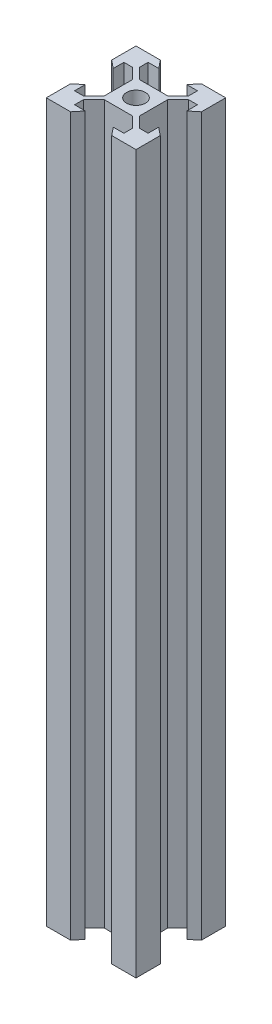
from build123d import *

# Parameters (mm, degrees)
SKETCH1_R           = 2.1
BOSS_EXTRUDE1_DEPTH = 160


with BuildPart() as part:
    # Sketch1 → Boss-Extrude1 (new body)
    with BuildSketch(Plane(origin=(0, 0, 0), x_dir=(1, 0, 0), z_dir=(0, 1, 0))):
        Polygon((0, 5.415), (0, 0), (4.5, 0), (5.42, 0), (6.875, 1.8), (4.5, 1.8), (4.5, 3.75), (6.85, 6.1), (13.15, 6.1), (15.5, 3.75), (15.5, 1.8), (13.147527473, 1.8), (14.58, 0), (20, 0), (20, 4.5), (20, 5.415), (18.2, 6.85), (18.2, 5.415), (18.2, 4.5), (16.25, 4.5), (13.9, 6.85), (13.9, 13.15), (16.25, 15.5), (18.2, 15.5), (18.2, 13.12), (20, 14.58), (20, 20), (15.5, 20), (14.58, 20), (13.125, 18.2), (15.5, 18.2), (15.5, 16.25), (13.15, 13.9), (6.85, 13.9), (4.5, 16.25), (4.5, 18.2), (6.875, 18.2), (5.42, 20), (4.5, 20), (0, 20), (0, 14.700042406), (0, 14.58), (1.8, 13.125), (1.8, 14.58), (1.8, 14.700042406), (1.8, 15.5), (3.75, 15.5), (6.1, 13.15), (6.1, 6.85), (3.75, 4.5), (1.8, 4.5), (1.8, 5.415), (1.8, 6.875), align=None)
        with Locations(Location((10, 10, 0), (0, 0, 270))):
            Circle(SKETCH1_R, mode=Mode.SUBTRACT)
    extrude(amount=BOSS_EXTRUDE1_DEPTH)


solid = part.part
